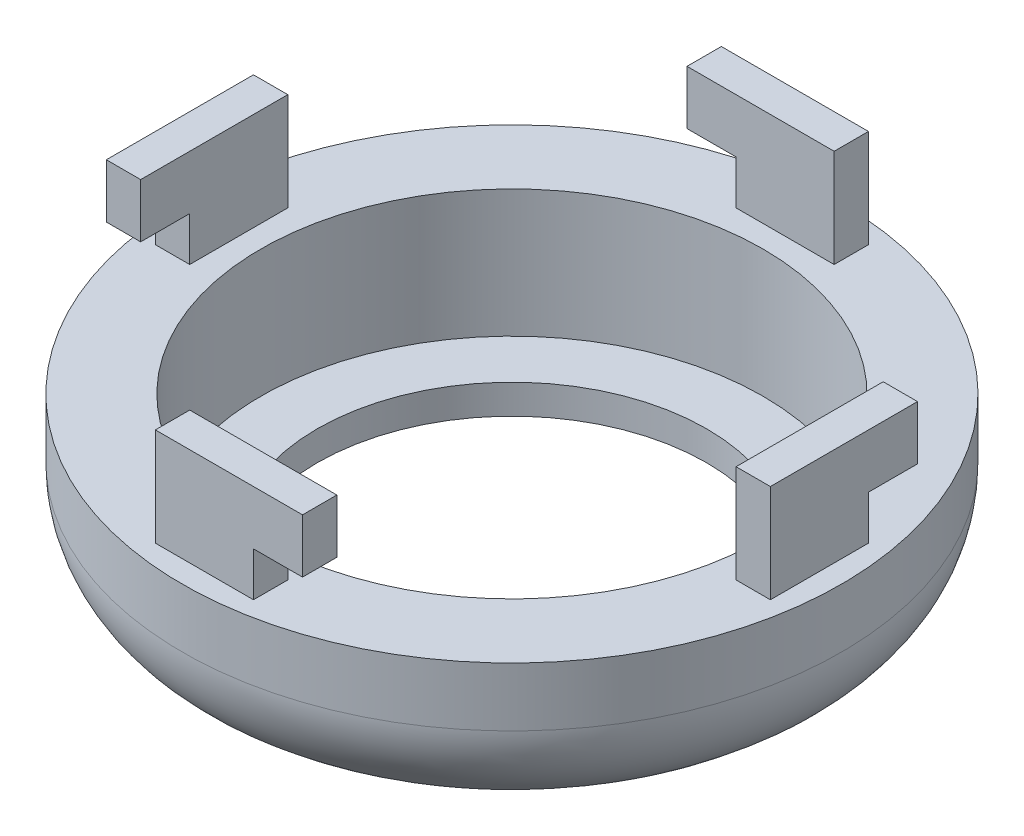
from build123d import *

# Parameters (mm, degrees)
SKETCH1_R           = 33.6
SKETCH1_R_2         = 25.6
BOSS_EXTRUDE1_DEPTH = 13
SKETCH2_W           = 10
SKETCH2_H           = 3.5
BOSS_EXTRUDE2_DEPTH = 10
BOSS_EXTRUDE3_START = 3
SKETCH3_R           = 33.6
SKETCH3_R_2         = 19.85
BOSS_EXTRUDE3_DEPTH = 3
SKETCH4_W           = 15
SKETCH4_H           = 5.5
BOSS_EXTRUDE4_DEPTH = 3.5
CIRPATTERN1_COUNT   = 4
FILLET1_R           = 10


with BuildPart() as part:
    # Sketch1 → Boss-Extrude1 (new body)
    with BuildSketch(Plane(origin=(0, 0, 0), x_dir=(1, 0, 0), z_dir=(0, 1, 0))):
        with Locations(Location((0, 0, 0), (0, 0, 90))):
            Circle(SKETCH1_R)
        with Locations(Location((0, 0, 0), (0, 0, 90))):
            Circle(SKETCH1_R_2, mode=Mode.SUBTRACT)
    extrude(amount=BOSS_EXTRUDE1_DEPTH)

    # Sketch2 → Boss-Extrude2 (add)
    with BuildSketch(Plane(origin=(0, 13, 0), x_dir=(1, 0, 0), z_dir=(0, 1, 0))):
        with Locations((0, -29.6)):
            Rectangle(SKETCH2_W, SKETCH2_H)
    boss_extrude2 = extrude(amount=BOSS_EXTRUDE2_DEPTH)

    # Sketch3 → Boss-Extrude3 (add)
    with BuildSketch(Plane.XZ.offset(BOSS_EXTRUDE3_START)):
        with Locations(Location((0, 0, 0), (0, 0, 270))):
            Circle(SKETCH3_R)
        with Locations(Location((0, 0, 0), (0, 0, 270))):
            Circle(SKETCH3_R_2, mode=Mode.SUBTRACT)
    extrude(amount=-BOSS_EXTRUDE3_DEPTH)

    # Sketch4 → Boss-Extrude4 (add)
    with BuildSketch(Plane.XY.offset(31.35)):
        with Locations((2.5, 20.25)):
            Rectangle(SKETCH4_W, SKETCH4_H)
    boss_extrude4 = extrude(amount=-BOSS_EXTRUDE4_DEPTH)

    # CirPattern1: Boss-Extrude2, Boss-Extrude4 ×4 about axis
    cirpattern1_axis = Axis((0, 0, 0), (0, 1, 0))
    add([boss_extrude2.rotate(cirpattern1_axis, i * 360 / CIRPATTERN1_COUNT) for i in range(1, CIRPATTERN1_COUNT)])
    add([boss_extrude4.rotate(cirpattern1_axis, i * 360 / CIRPATTERN1_COUNT) for i in range(1, CIRPATTERN1_COUNT)])

    # Fillet1
    fillet1_edges = [part.edges().sort_by_distance(p)[0] for p in [
        (0, -3, 33.6),
    ]]
    fillet(fillet1_edges, radius=FILLET1_R)


solid = part.part
